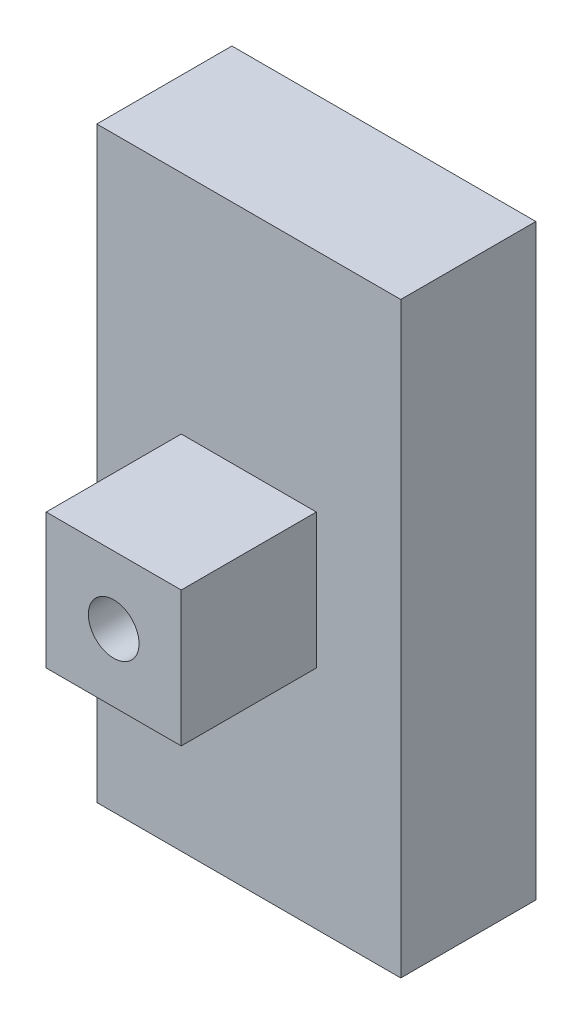
from build123d import *

# Parameters (mm, degrees)
SKETCH_1_W          = 90
SKETCH_1_H          = 174
EXTRUDE_1_DEPTH     = 40
SKETCH_2_W          = 40
SKETCH_2_H          = 40
EXTRUDE_2_DEPTH     = 40
SKETCH_3_R          = 7.5
CUT_EXTRUDE_1_DEPTH = 40


with BuildPart() as part:
    # 草图1 → 凸台-拉伸1 (new body)
    with BuildSketch(Plane.XY):
        Rectangle(SKETCH_1_W, SKETCH_1_H)
    extrude(amount=EXTRUDE_1_DEPTH)

    # 草图2 → 凸台-拉伸2 (add)
    with BuildSketch(Plane.XY.offset(40)):
        Rectangle(SKETCH_2_W, SKETCH_2_H)
    extrude(amount=EXTRUDE_2_DEPTH)

    # 草图3 → 切除-拉伸1 (cut)
    with BuildSketch(Plane.XY.offset(80)):
        Circle(SKETCH_3_R)
    extrude(amount=-CUT_EXTRUDE_1_DEPTH, mode=Mode.SUBTRACT)


solid = part.part
